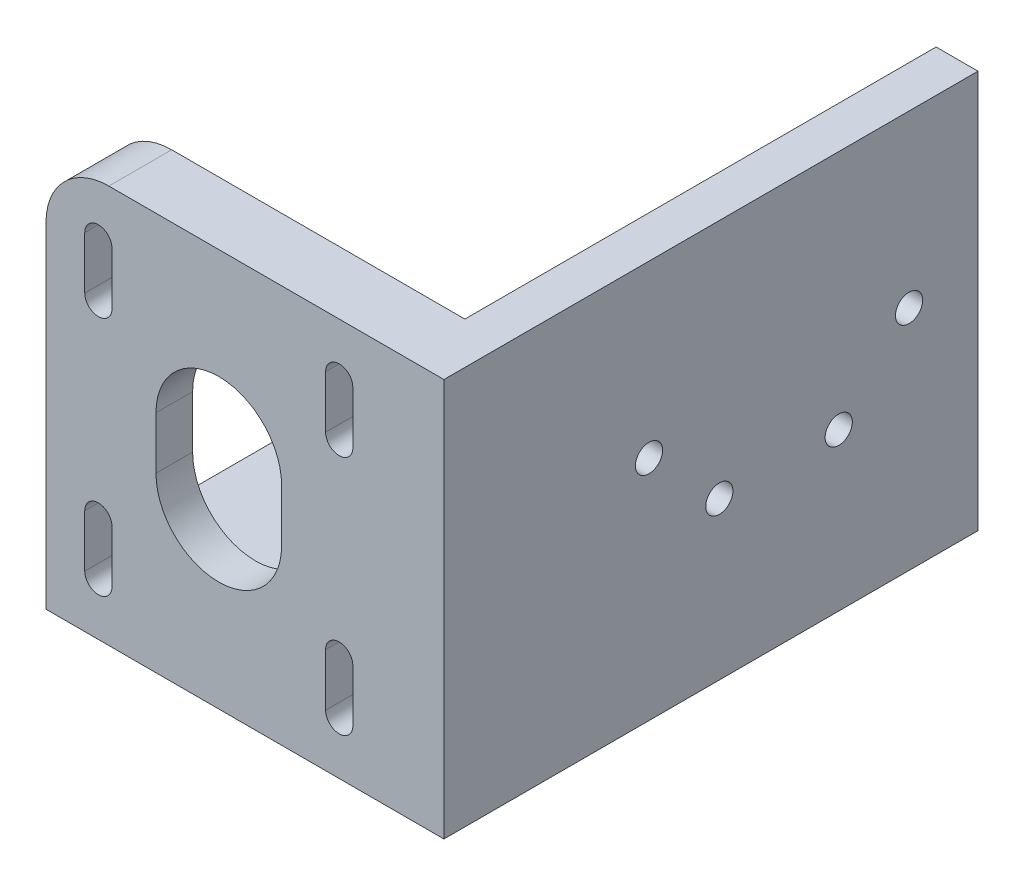
from build123d import *

# Parameters (mm, degrees)
SKETCH1_W           = 38
SKETCH1_H           = 38
BOSS_EXTRUDE1_DEPTH = 6
BOSS_EXTRUDE2_DEPTH = 45
CUT_EXTRUDE1_DEPTH  = 6
CUT_EXTRUDE2_DEPTH  = 2.5
SKETCH6_R           = 1.3
CUT_EXTRUDE3_DEPTH  = 4
FILLET1_R           = 2
FILLET2_R           = 6


with BuildPart() as part:
    # Sketch1 → Boss-Extrude1 (new body)
    with BuildSketch(Plane.XY):
        with Locations((19, 19)):
            Rectangle(SKETCH1_W, SKETCH1_H)
    extrude(amount=BOSS_EXTRUDE1_DEPTH)

    # Sketch2 → Boss-Extrude2 (add)
    with BuildSketch(Plane(origin=(0, 0, 0), x_dir=(-1, 0, 0), z_dir=(0, 0, -1))):
        Polygon((-34, 38), (-34, 3), (0, 3), (0, 0), (-38, 0), (-38, 38), align=None)
    extrude(amount=BOSS_EXTRUDE2_DEPTH)

    # Sketch3 → Cut-Extrude1 (cut)
    with BuildSketch(Plane.XY.offset(6)):
        with BuildLine():
            Line((6.3, 33), (6.3, 28))
            ThreePointArc((6.3, 28), (5, 26.7), (3.7, 28))
            Line((3.7, 28), (3.7, 33))
            ThreePointArc((3.7, 33), (5, 34.3), (6.3, 33))
        make_face()
        with BuildLine():
            Line((29.3, 33), (29.3, 28))
            ThreePointArc((29.3, 28), (28, 26.7), (26.7, 28))
            Line((26.7, 28), (26.7, 33))
            ThreePointArc((26.7, 33), (28, 34.3), (29.3, 33))
        make_face()
        with BuildLine():
            Line((6.3, 10), (6.3, 5))
            ThreePointArc((6.3, 5), (5, 3.7), (3.7, 5))
            Line((3.7, 5), (3.7, 10))
            ThreePointArc((3.7, 10), (5, 11.3), (6.3, 10))
        make_face()
        with BuildLine():
            Line((29.3, 10), (29.3, 5))
            ThreePointArc((29.3, 5), (28, 3.7), (26.7, 5))
            Line((26.7, 5), (26.7, 10))
            ThreePointArc((26.7, 10), (28, 11.3), (29.3, 10))
        make_face()
        with BuildLine():
            Line((22.5, 21.5), (22.5, 16.5))
            ThreePointArc((22.5, 16.5), (16.5, 10.5), (10.5, 16.5))
            Line((10.5, 16.5), (10.5, 21.5))
            ThreePointArc((10.5, 21.5), (16.5, 27.5), (22.5, 21.5))
        make_face()
    extrude(amount=-CUT_EXTRUDE1_DEPTH, mode=Mode.SUBTRACT)

    # Sketch5 → Cut-Extrude2 (cut)
    with BuildSketch(Plane(origin=(0, 0, 0), x_dir=(-1, 0, 0), z_dir=(0, 0, -1))):
        with BuildLine():
            Line((-5, 21.5), (-5, 16.5))
            ThreePointArc((-5, 16.5), (-16.5, 5), (-28, 16.5))
            Line((-28, 16.5), (-28, 21.5))
            ThreePointArc((-28, 21.5), (-16.5, 33), (-5, 21.5))
        make_face()
    extrude(amount=-CUT_EXTRUDE2_DEPTH, mode=Mode.SUBTRACT)

    # Sketch6 → Cut-Extrude3 (cut)
    with BuildSketch(Plane(origin=(38, 0, 0), x_dir=(0, 0, -1), z_dir=(1, 0, 0))):
        with Locations((13.582485579, 21.717514421)):
            Circle(SKETCH6_R)
        with Locations((20.3, 15)):
            Circle(SKETCH6_R)
        with Locations((38.417514421, 21.717514421)):
            Circle(SKETCH6_R)
        with Locations((31.7, 15)):
            Circle(SKETCH6_R)
    extrude(amount=-CUT_EXTRUDE3_DEPTH, mode=Mode.SUBTRACT)

    # Fillet1
    fillet1_edges = [part.edges().sort_by_distance(p)[0] for p in [
        (34, 3, -22.5),
    ]]
    fillet(fillet1_edges, radius=FILLET1_R)

    # Fillet2
    fillet2_edges = [part.edges().sort_by_distance(p)[0] for p in [
        (0, 38, 3),
    ]]
    fillet(fillet2_edges, radius=FILLET2_R)


solid = part.part
